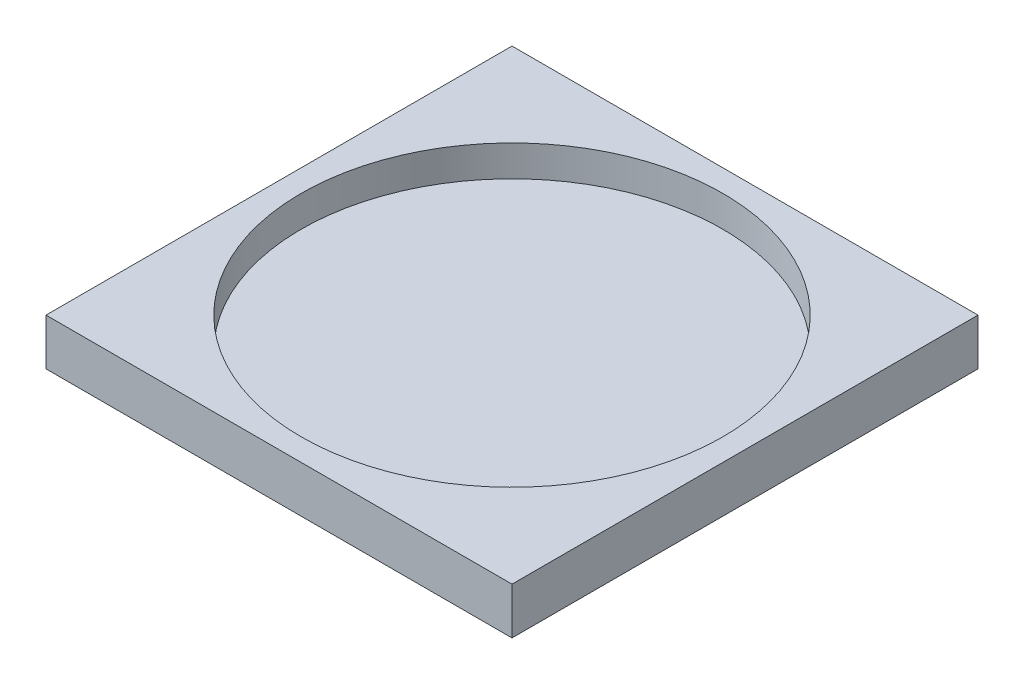
from build123d import *

# Parameters (mm, degrees)
CROQUIS1_W              = 30
CROQUIS1_H              = 30
SALIENTE_EXTRUIR1_DEPTH = 3
CROQUIS2_R              = 13.575
CORTAR_EXTRUIR1_DEPTH   = 2


with BuildPart() as part:
    # Croquis1 → Saliente-Extruir1 (new body)
    with BuildSketch(Plane(origin=(0, 0, 0), x_dir=(1, 0, 0), z_dir=(0, 1, 0))):
        Rectangle(CROQUIS1_W, CROQUIS1_H)
    extrude(amount=SALIENTE_EXTRUIR1_DEPTH)

    # Croquis2 → Cortar-Extruir1 (cut)
    with BuildSketch(Plane(origin=(0, 3, 0), x_dir=(1, 0, 0), z_dir=(0, 1, 0))):
        with Locations(Location((0, 0, 0), (0, 0, 270))):
            Circle(CROQUIS2_R)
    extrude(amount=-CORTAR_EXTRUIR1_DEPTH, mode=Mode.SUBTRACT)


solid = part.part
